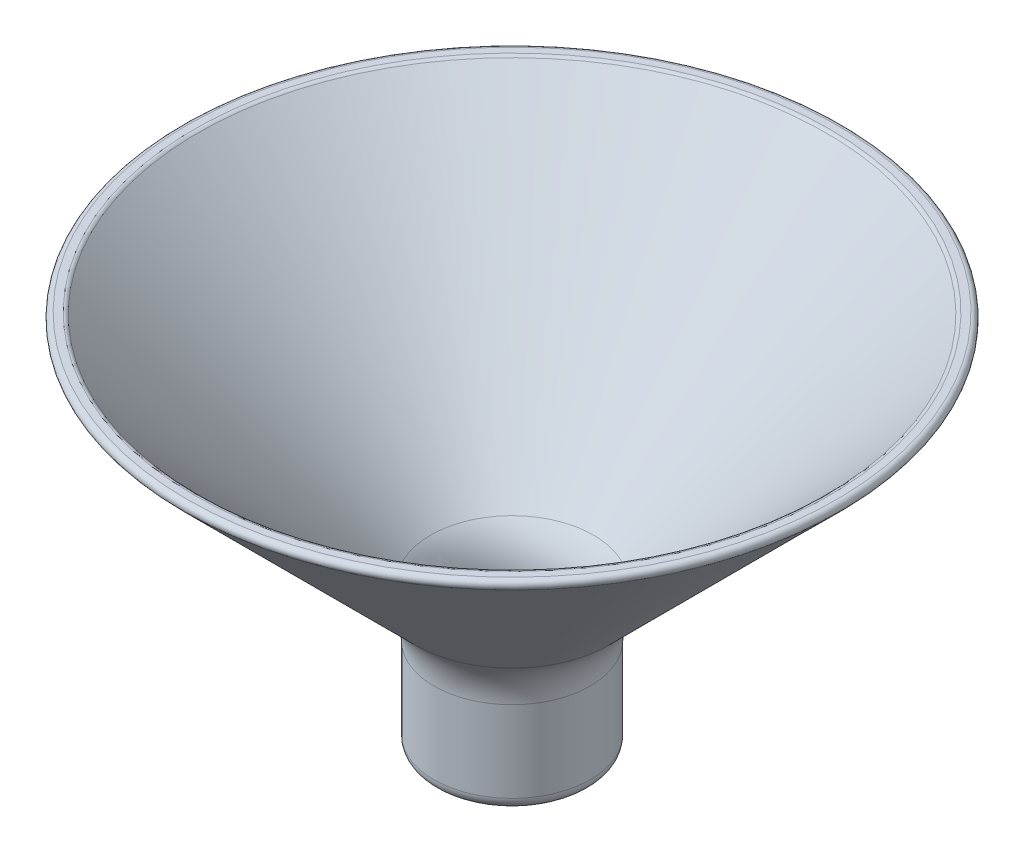
from build123d import *

# Parameters (mm, degrees)
FILLET1_R = 5
FILLET2_R = 0.4
FILLET3_R = 1


with BuildPart() as part:
    # Sketch1 → Revolve1 (revolve)
    with BuildSketch(Plane.XY, mode=Mode.PRIVATE) as revolve1_sk:
        Polygon((5, 5.196152423), (5, 10), (25, 30), (26.697056275, 30), (6.2, 9.502943725), (6.2, 4.874613392), (6.2, 0), (2, 0), align=None)
    revolve(revolve1_sk.sketch.rotate(Axis((0, 0, 0), (0, 1, 0)), 90), axis=Axis((0, 0, 0), (0, 1, 0)))

    # Fillet1
    fillet1_edges = [part.edges().sort_by_distance(p)[0] for p in [
        (0, 9.502943725, 6.2),
        (0, 10, 5),
    ]]
    fillet(fillet1_edges, radius=FILLET1_R)

    # Fillet2
    fillet2_edges = [part.edges().sort_by_distance(p)[0] for p in [
        (0, 30, 26.697056275),
        (0, 30, 25),
    ]]
    fillet(fillet2_edges, radius=FILLET2_R)

    # Fillet3
    fillet3_edges = [part.edges().sort_by_distance(p)[0] for p in [
        (0, 0, 6.2),
    ]]
    fillet(fillet3_edges, radius=FILLET3_R)


solid = part.part
